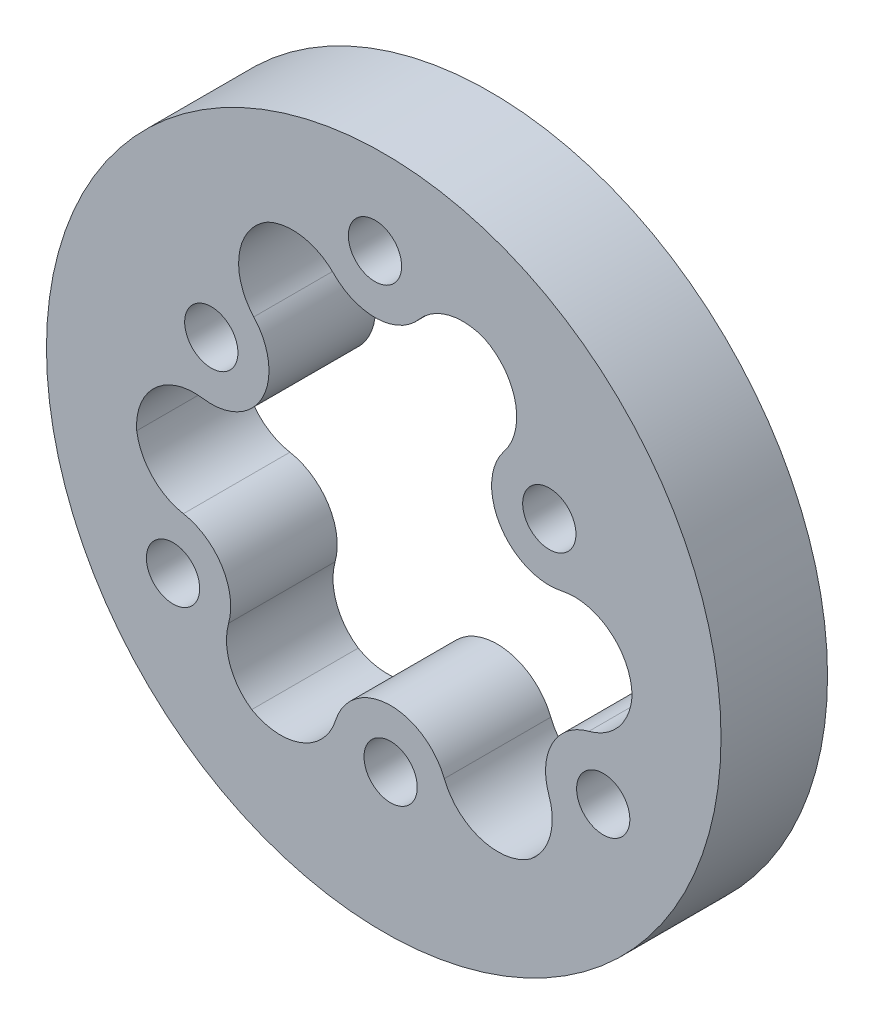
from build123d import *

# Parameters (mm, degrees)
ESQUISSE1_R        = 19
ESQUISSE1_R_2      = 1.5
BOSS_EXTRU_2_DEPTH = 6


with BuildPart() as part:
    # Esquisse1 → Boss.-Extru.2 (new body)
    with BuildSketch(Plane.XY):
        Circle(ESQUISSE1_R)
        with Locations((-0.493805045, 13.991288596)):
            Circle(ESQUISSE1_R_2, mode=Mode.SUBTRACT)
        with Locations((12.363713879, -6.567996584)):
            Circle(ESQUISSE1_R_2, mode=Mode.SUBTRACT)
        with Locations((-11.869908833, -7.423292012)):
            Circle(ESQUISSE1_R_2, mode=Mode.SUBTRACT)
        with Locations((-9.714346619, 5.160568745)):
            Circle(ESQUISSE1_R_2, mode=Mode.SUBTRACT)
        with Locations((9.32635694, 5.832586581)):
            Circle(ESQUISSE1_R_2, mode=Mode.SUBTRACT)
        with Locations((0.387989679, -10.993155325)):
            Circle(ESQUISSE1_R_2, mode=Mode.SUBTRACT)
        with BuildLine():
            ThreePointArc((-2.815595301, 11.717131607), (-0.379171731, 10.743310886), (1.982535482, 11.886475637))
            ThreePointArc((1.982535482, 11.886475637), (3.675716254, 12.935891711), (5.663115611, 12.800322476))
            ThreePointArc((5.663115611, 12.800322476), (7.409047573, 10.596596907), (6.782830345, 7.855696182))
            ThreePointArc((6.782830345, 7.855696182), (6.57084239, 4.109322364), (10.032070946, 2.660132051))
            ThreePointArc((10.032070946, 2.660132051), (12.770566856, 2.023480694), (13.987784639, -0.510896087))
            ThreePointArc((13.987784639, -0.510896087), (13.239790253, -2.357146239), (11.555131282, -3.420188746))
            ThreePointArc((11.555131282, -3.420188746), (9.493566014, -5.043283091), (9.302722122, -7.66016391))
            ThreePointArc((9.302722122, -7.66016391), (9.364952716, -9.651209509), (8.253846635, -11.304563222))
            ThreePointArc((8.253846635, -11.304563222), (5.472398329, -11.71472187), (3.411817286, -9.80195148))
            ThreePointArc((3.411817286, -9.80195148), (0.273356364, -7.745177616), (-2.712293539, -10.018094318))
            ThreePointArc((-2.712293539, -10.018094318), (-4.632897743, -12.071375665), (-7.436341309, -11.858328797))
            ThreePointArc((-7.436341309, -11.858328797), (-8.66124365, -10.287421581), (-8.739535981, -8.296942861))
            ThreePointArc((-8.739535981, -8.296942861), (-9.114394283, -5.700027795), (-11.285257604, -4.226311727))
            ThreePointArc((-11.285257604, -4.226311727), (-13.04066897, -3.284682203), (-13.916962247, -1.495759254))
            ThreePointArc((-13.916962247, -1.495759254), (-12.881445902, 1.118124963), (-10.194647631, 1.946255297))
            ThreePointArc((-10.194647631, 1.946255297), (-6.844198754, 3.635855252), (-7.319777407, 7.357962266))
            ThreePointArc((-7.319777407, 7.357962266), (-8.137669113, 10.047894971), (-6.55144333, 12.369224883))
            ThreePointArc((-6.55144333, 12.369224883), (-4.578546604, 12.64456782), (-2.815595301, 11.717131607))
        make_face(mode=Mode.SUBTRACT)
    extrude(amount=BOSS_EXTRU_2_DEPTH)


solid = part.part
